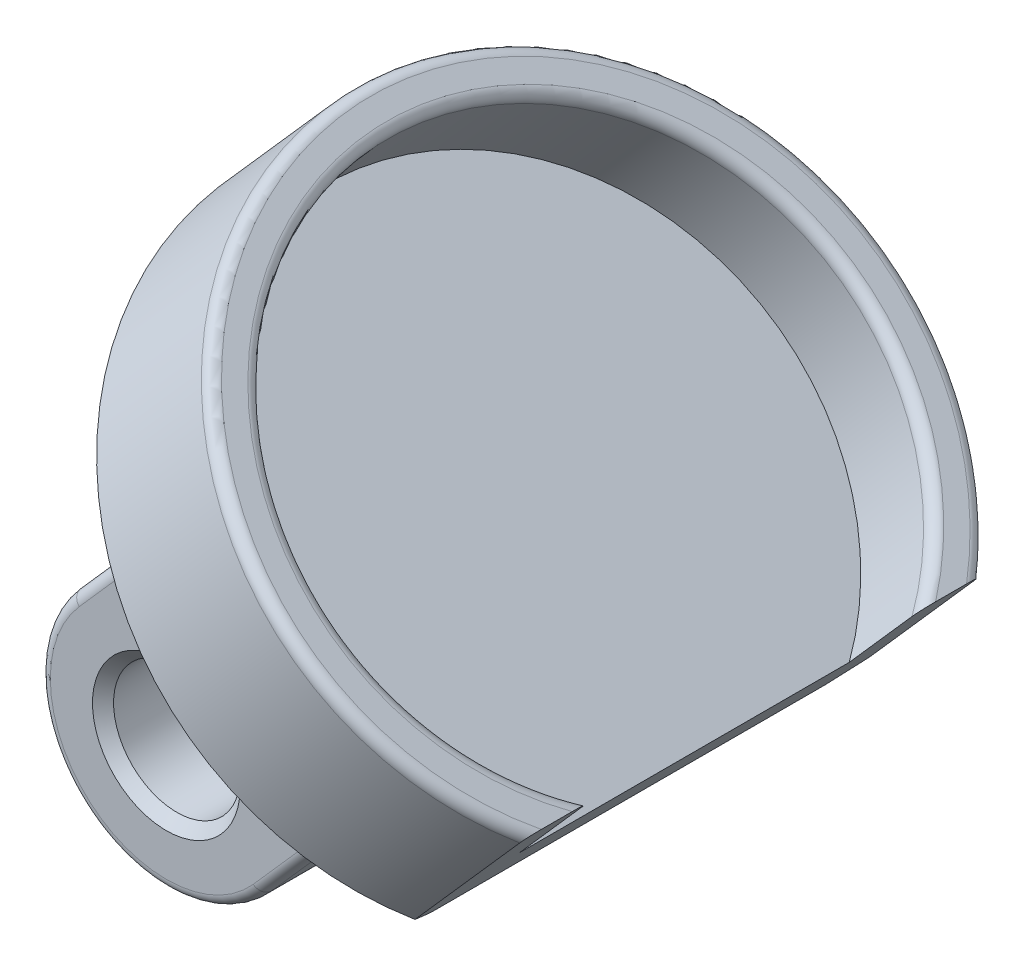
from build123d import *

# Parameters (mm, degrees)
BOSS_EXTRUDE1_DEPTH      = 7
BOSS_EXTRUDE1_DEPTH_BACK = 7
SKETCH2_R                = 3.0000000000000018
BOSS_EXTRUDE2_DEPTH      = 2
BOSS_EXTRUDE2_DEPTH_BACK = 2
SKETCH3_R                = 14.700000000000001
BOSS_EXTRUDE3_START      = 5
SKETCH4_R                = 14.700000000000001
SKETCH4_R_2              = 12.699999999999998
BOSS_EXTRUDE3_DEPTH      = 5
FILLET2_R                = 0.5
FILLET4_R                = 0.5
CHAMFER1_SIZE            = 0.5
CHAMFER2_SIZE            = 1
CUT_EXTRUDE1_DEPTH       = 54.24291481918433


with BuildPart() as part:
    # Sketch2 → Boss-Extrude1 (new, two sides: drawn at the far end of the back side and taken through both)
    with BuildSketch(Plane.XY.offset(-BOSS_EXTRUDE1_DEPTH_BACK)):
        with BuildLine():
            Line((30.512377936980783, 70.89647327651264), (21.781878923827843, 61.0053372557492))
            ThreePointArc((21.781878923827843, 61.0053372557492), (13.313031061350836, 60.477496482202135), (12.78519028780376, 68.94634434467913))
            Line((12.78519028780376, 68.94634434467913), (21.51568930095671, 78.83748036544256))
            Line((21.51568930095671, 78.83748036544256), (30.512377936980783, 70.89647327651264))
        make_face()
        with Locations((17.283534605815802, 64.97584080021417)):
            Circle(SKETCH2_R, mode=Mode.SUBTRACT)
    extrude(amount=BOSS_EXTRUDE1_DEPTH + BOSS_EXTRUDE1_DEPTH_BACK)

    # Sketch3 → Boss-Extrude2 (add, two sides: drawn at the far end of the back side and taken through both)
    with BuildSketch(Plane(origin=(48.53568375746082, 54.98804239970119, 0), x_dir=(0.7497240530020064, -0.66175059074416, 0), z_dir=(0.66175059074416, 0.7497240530020064, 0)).offset(-BOSS_EXTRUDE2_DEPTH_BACK)):
        with Locations((-30.039919418767553, 0)):
            Circle(SKETCH3_R)
    extrude(amount=BOSS_EXTRUDE2_DEPTH + BOSS_EXTRUDE2_DEPTH_BACK)

    # Sketch4 → Boss-Extrude3 (add)
    with BuildSketch(Plane(origin=(49.85918493894915, 56.48749050570521, 0), x_dir=(0.7497240530020064, -0.66175059074416, 0), z_dir=(0.66175059074416, 0.7497240530020064, 0)).offset(BOSS_EXTRUDE3_START)):
        with Locations((-30.03991941876756, 0)):
            Circle(SKETCH4_R)
        with Locations((-30.03991941876756, 0)):
            Circle(SKETCH4_R_2, mode=Mode.SUBTRACT)
    extrude(amount=-BOSS_EXTRUDE3_DEPTH)

    # Fillet2
    fillet2_edges = [part.edges().sort_by_distance(p)[0] for p in [
        (21.12479228105238, 88.51927769444247, -1.56e-15),
        (19.62534417504836, 89.84277887593079, -1.8e-15),
    ]]
    fillet(fillet2_edges, radius=FILLET2_R)

    # Fillet4
    fillet4_edges = [part.edges().sort_by_distance(p)[0] for p in [
        (25.48537783966015, 65.2011812131289, -7),
        (13.313031061350841, 60.47749648220213, -7),
        (16.488689203636067, 73.14218830205883, -7),
        (25.48537783966015, 65.2011812131289, 7),
        (13.313031061350841, 60.47749648220213, 7),
        (16.488689203636067, 73.14218830205883, 7),
    ]]
    fillet(fillet4_edges, radius=FILLET4_R)

    # Chamfer1
    chamfer1_edges = [part.edges().sort_by_distance(p)[0] for p in [
        (14.2835346058158, 64.97584080021417, 7),
        (14.2835346058158, 64.97584080021417, -7),
    ]]
    chamfer(chamfer1_edges, length=CHAMFER1_SIZE)

    # Chamfer2
    chamfer2_edges = [part.edges().sort_by_distance(p)[0] for p in [
        (20.301982665021182, 77.24112112915115, 6.853553390593271),
        (20.192188119468376, 77.33803225943853, -7e-17),
        (20.301982665021182, 77.24112112915115, -6.853553390593271),
        (24.690532437480417, 73.36752871497357, -7),
        (29.079082209939642, 69.493936300796, -6.853553390593275),
        (29.18887675549246, 69.39702517050861, -7e-17),
        (29.079082209939642, 69.493936300796, 6.853553390593275),
        (24.690532437480417, 73.36752871497357, 7),
        (13.66958885835092, 83.09526239891272, -1.8e-15),
    ]]
    chamfer(chamfer2_edges, length=CHAMFER2_SIZE)

    # Sketch5 → Cut-Extrude1 (cut, through all)
    with BuildSketch(Plane(origin=(53.16793789266995, 60.23611077071524, 0), x_dir=(0.7497240530020064, -0.66175059074416, 0), z_dir=(0.66175059074416, 0.7497240530020064, 0))):
        Polygon((-10.039919418767552, 12.5), (-10.039919418767552, -12.5), (-20.03991941876755, -12.500000000000004), (-20.03991941876755, 12.500000000000004), align=None)
    extrude(amount=-CUT_EXTRUDE1_DEPTH, mode=Mode.SUBTRACT)


solid = part.part
